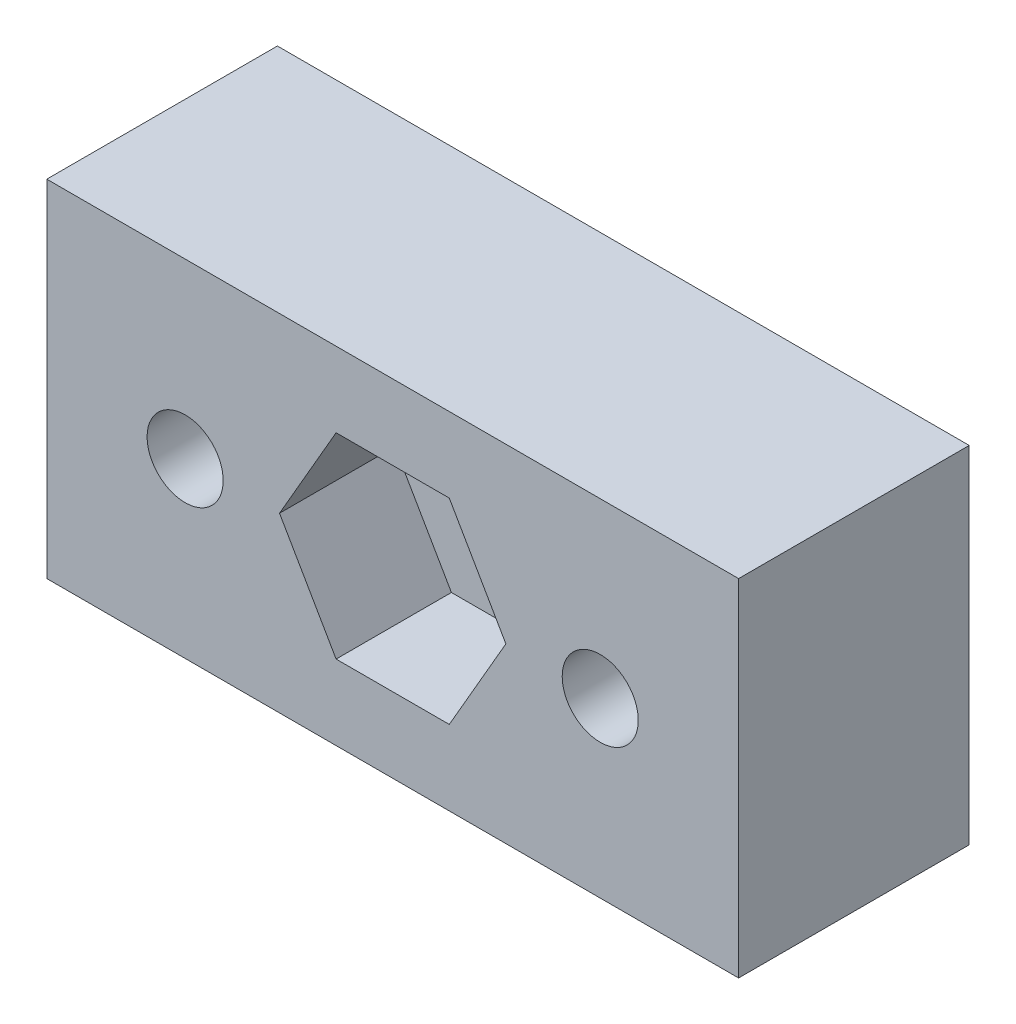
from build123d import *

# Parameters (mm, degrees)
SKETCH3_W                                    = 60
SKETCH3_H                                    = 30
BOSS_EXTRUDE1_DEPTH                          = 10
CBORE_FOR_M6_HEX_HEAD_CAP_SCREW1_D           = 6.6
CBORE_FOR_M6_HEX_HEAD_CAP_SCREW1_CBORE_D     = 10.5
CBORE_FOR_M6_HEX_HEAD_CAP_SCREW1_CBORE_DEPTH = 7.5
CUT_EXTRUDE1_DEPTH                           = 10


with BuildPart() as part:
    # Sketch3 → Boss-Extrude1 (new, symmetric)
    with BuildSketch(Plane.XY):
        Rectangle(SKETCH3_W, SKETCH3_H)
    extrude(amount=BOSS_EXTRUDE1_DEPTH, both=True)

    # CBORE for M6 Hex Head Cap Screw1 (through all)
    with Locations(Plane(origin=(0, 0, -10), x_dir=(-1, 0, 0), z_dir=(0, 0, -1))):
        with Locations((18, 0), (-18, 0)):
            CounterBoreHole(CBORE_FOR_M6_HEX_HEAD_CAP_SCREW1_D / 2, CBORE_FOR_M6_HEX_HEAD_CAP_SCREW1_CBORE_D / 2, CBORE_FOR_M6_HEX_HEAD_CAP_SCREW1_CBORE_DEPTH)

    # Sketch9 → Tap Drill for M12 Tap1 (revolve, cut)
    with BuildSketch(Plane(origin=(0, 0, -10), x_dir=(0, 1, 0), z_dir=(1, 0, 0))):
        Polygon((0, 0), (0, 20), (5.125, 20), (5.1, 19.975), (5.1, 0.025), (5.125, 0), align=None)
    revolve(axis=Axis((0, 0, -16.35), (0, 0, 1)), mode=Mode.SUBTRACT)

    # Sketch11 → Cut-Extrude1 (cut)
    with BuildSketch(Plane(origin=(0, 0, 10), x_dir=(-1, 0, 0), z_dir=(0, 0, -1))):
        Polygon((4.907477288, 8.5), (-4.907477288, 8.5), (-9.814954576, 0), (-4.907477288, -8.5), (4.907477288, -8.5), (9.814954576, 0), align=None)
    extrude(amount=CUT_EXTRUDE1_DEPTH, mode=Mode.SUBTRACT)


solid = part.part
